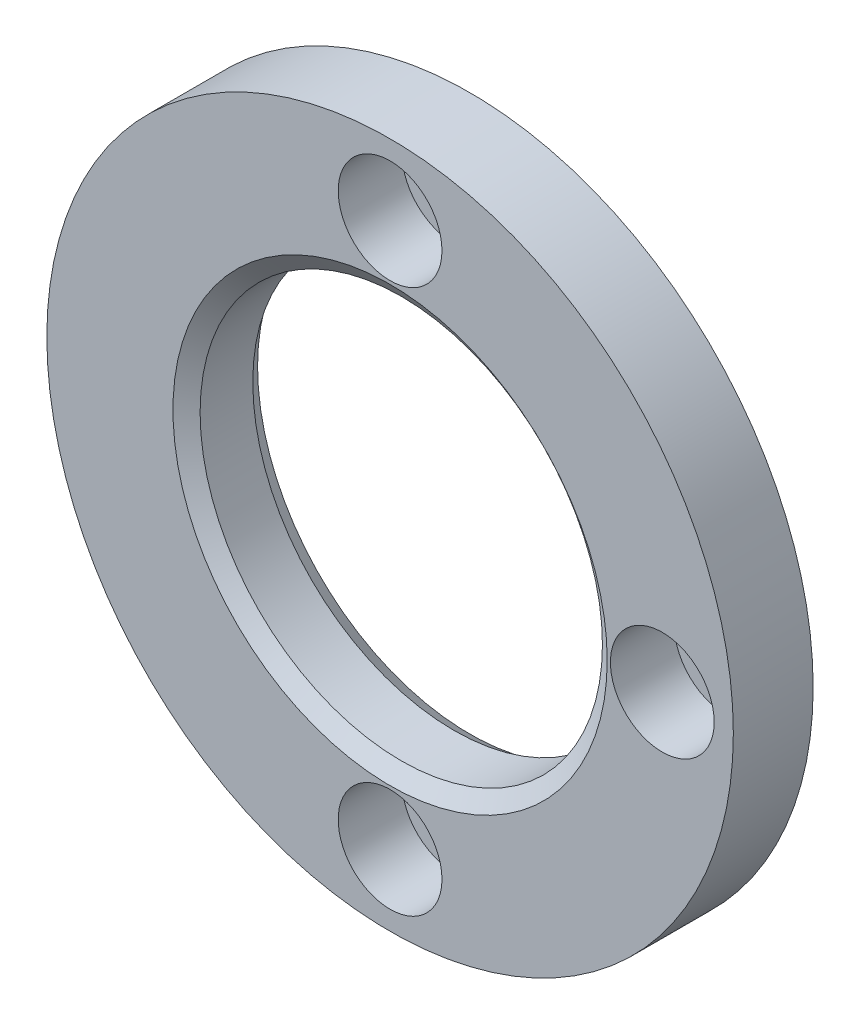
from build123d import *
from OCP.BRepFilletAPI import BRepFilletAPI_MakeChamfer

# Parameters (mm, degrees)
SKETCH1_R           = 43
SKETCH1_R_2         = 25.2
BOSS_EXTRUDE1_DEPTH = 10
SKETCH2_R           = 6.5
CUT_EXTRUDE1_DEPTH  = 143.860071399
CHAMFER1_SIZE       = 2
CHAMFER1_SIZE2      = 1.400415076


with BuildPart() as part:
    # Sketch1 → Boss-Extrude1 (new body)
    with BuildSketch(Plane.XY):
        with Locations((93, 0)):
            Circle(SKETCH1_R)
        with Locations((93, 0)):
            Circle(SKETCH1_R_2, mode=Mode.SUBTRACT)
    extrude(amount=BOSS_EXTRUDE1_DEPTH)

    # Sketch2 → Cut-Extrude1 (cut, through all)
    with BuildSketch(Plane.XY.offset(2)):
        with Locations((93, 34.1)):
            Circle(SKETCH2_R)
        with Locations((127.1, 0)):
            Circle(SKETCH2_R)
        with Locations((93, -34.1)):
            Circle(SKETCH2_R)
    extrude(amount=CUT_EXTRUDE1_DEPTH, mode=Mode.SUBTRACT)

    # Chamfer1: one chamfer whose edges measure the first distance from different faces: ONE call of the kernel's chamfer builder (chamfer() names one face for all edges)
    chamfer1_edges_1 = [part.edges().sort_by_distance(p)[0] for p in [
        (67.8, 0, 0),
    ]]
    chamfer1_side_1 = [part.faces().sort_by_distance(p)[0] for p in [
        (67.8, 0, 5),
    ]]
    chamfer1_edges_2 = [part.edges().sort_by_distance(p)[0] for p in [
        (67.8, 0, 10),
    ]]
    chamfer1_side_2 = [part.faces().sort_by_distance(p)[0] for p in [
        (51.216223664, 0, 10),
    ]]
    chamfer1 = BRepFilletAPI_MakeChamfer(part.part.solid().wrapped)
    for e in chamfer1_edges_1:
        chamfer1.Add(CHAMFER1_SIZE, CHAMFER1_SIZE2, e.wrapped, chamfer1_side_1[0].wrapped)  # the first distance lies on this face
    for e in chamfer1_edges_2:
        chamfer1.Add(CHAMFER1_SIZE, CHAMFER1_SIZE2, e.wrapped, chamfer1_side_2[0].wrapped)  # the first distance lies on this face
    add(Compound.cast(chamfer1.Shape()), mode=Mode.REPLACE)


solid = part.part
